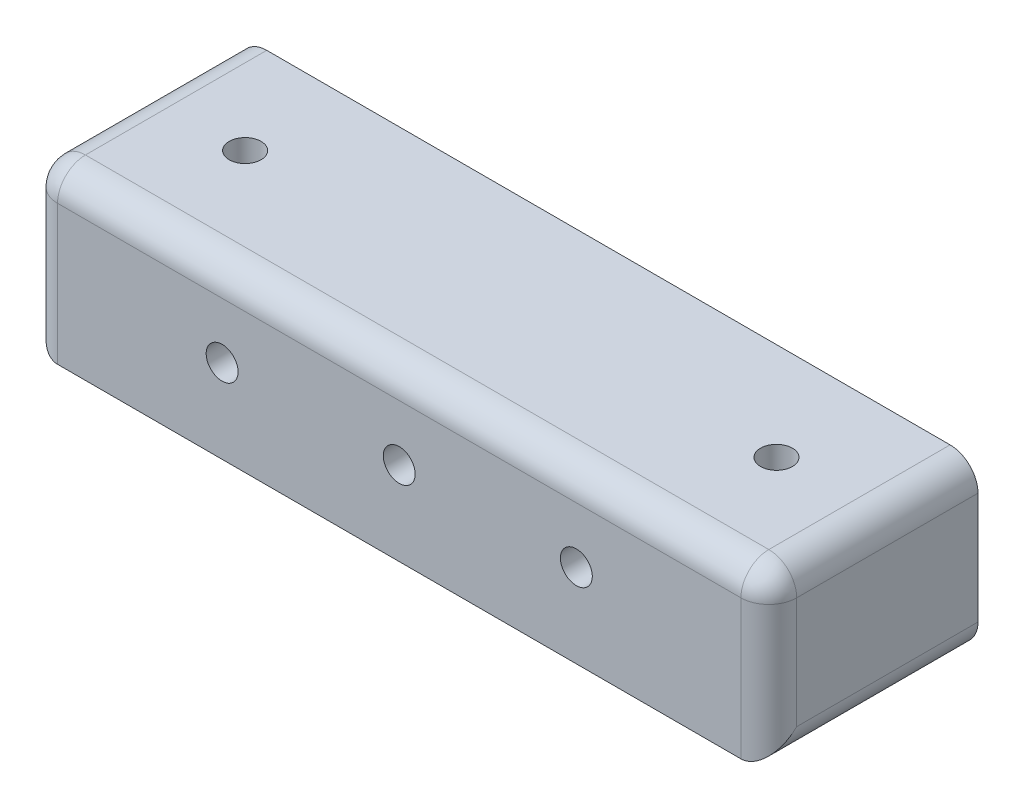
from build123d import *

# Parameters (mm, degrees)
SKETCH1_W           = 53
SKETCH1_H           = 12
BOSS_EXTRUDE1_DEPTH = 15
CUT_EXTRUDE1_REACH  = 34.73
SKETCH2_R           = 1.143
FILLET1_R           = 2
SKETCH3_R           = 1.143
CUT_EXTRUDE2_DEPTH  = 32.036269106


with BuildPart() as part:
    # Sketch1 → Boss-Extrude1 (new body)
    with BuildSketch(Plane.XY):
        Rectangle(SKETCH1_W, SKETCH1_H)
    extrude(amount=BOSS_EXTRUDE1_DEPTH)

    # Sketch2 → Cut-Extrude1 (cut, up to next)
    with BuildSketch(Plane.XZ.offset(6), mode=Mode.PRIVATE) as cut_extrude1_sk1:
        with Locations(Location((-19.05, 7, 0), (0, 0, 270))):
            Circle(SKETCH2_R)
    cut_extrude1_tool1 = extrude(cut_extrude1_sk1.sketch, amount=-CUT_EXTRUDE1_REACH, mode=Mode.PRIVATE) & part.part
    # Sketch2 → Cut-Extrude1 (cut, up to next)
    with BuildSketch(Plane.XZ.offset(6), mode=Mode.PRIVATE) as cut_extrude1_sk2:
        with Locations(Location((19.05, 7, 0), (0, 0, 270))):
            Circle(SKETCH2_R)
    cut_extrude1_tool2 = extrude(cut_extrude1_sk2.sketch, amount=-CUT_EXTRUDE1_REACH, mode=Mode.PRIVATE) & part.part
    add(cut_extrude1_tool1.solids().sort_by_distance((-19.05, -6, 7))[0], mode=Mode.SUBTRACT)
    add(cut_extrude1_tool2.solids().sort_by_distance((19.05, -6, 7))[0], mode=Mode.SUBTRACT)

    # Fillet1
    fillet1_edges = [part.edges().sort_by_distance(p)[0] for p in [
        (-26.5, 0, 15),
        (26.5, 0, 15),
        (0, 6, 15),
        (26.5, -6, 7.5),
        (-26.5, -6, 7.5),
        (-26.5, 6, 7.5),
        (26.5, 6, 7.5),
    ]]
    fillet(fillet1_edges, radius=FILLET1_R)

    # Sketch3 → Cut-Extrude2 (cut, through all)
    with BuildSketch(Plane(origin=(0, 0, 0), x_dir=(-1, 0, 0), z_dir=(0, 0, -1))):
        with Locations((-12.7, 0)):
            Circle(SKETCH3_R)
        with Locations((12.7, 0)):
            Circle(SKETCH3_R)
        Circle(SKETCH3_R)
    extrude(amount=-CUT_EXTRUDE2_DEPTH, mode=Mode.SUBTRACT)


solid = part.part
